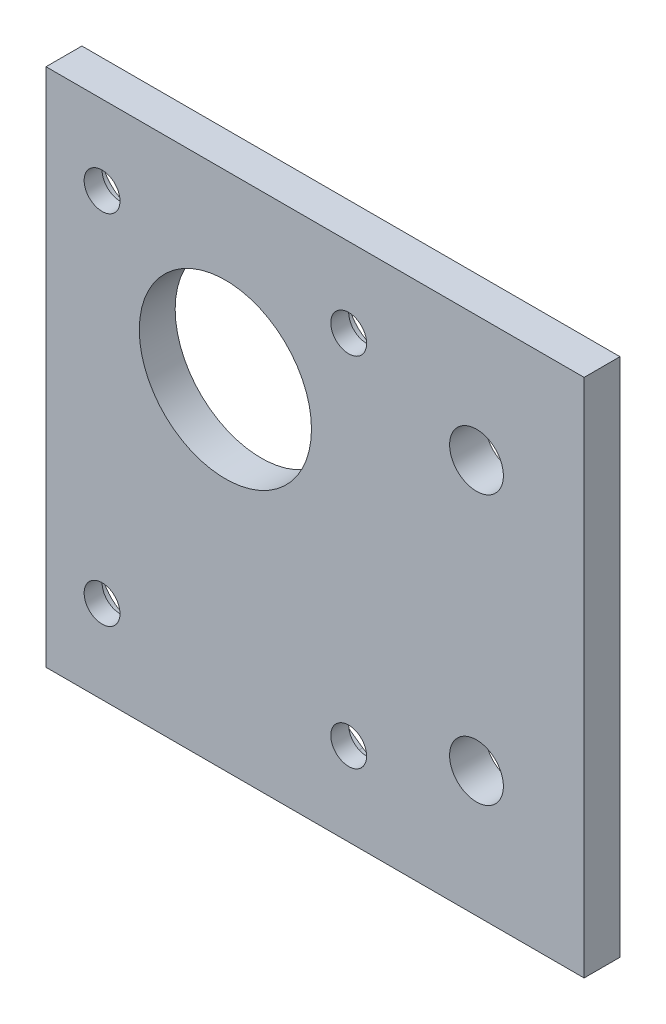
from build123d import *

# Parameters (mm, degrees)
SKETCH1_W           = 60
SKETCH1_H           = 58
SKETCH1_R           = 4.2
SKETCH1_R_2         = 9.6
BOSS_EXTRUDE1_DEPTH = 2
SKETCH4_W           = 60
SKETCH4_H           = 58
SKETCH4_R           = 2
SKETCH4_R_2         = 9.6
BOSS_EXTRUDE3_DEPTH = 2
SKETCH5_R           = 3
CUT_EXTRUDE1_DEPTH  = 4


with BuildPart() as part:
    # Sketch1 → Boss-Extrude1 (new body)
    with BuildSketch(Plane.XY):
        with Locations((10, 0)):
            Rectangle(SKETCH1_W, SKETCH1_H)
        with Locations((13.75, 20.15)):
            Circle(SKETCH1_R, mode=Mode.SUBTRACT)
        with Locations((-13.75, -19.7)):
            Circle(SKETCH1_R, mode=Mode.SUBTRACT)
        with Locations((-5.725, -6.1)):
            Circle(SKETCH1_R, mode=Mode.SUBTRACT)
        with Locations((5.725, -6.1)):
            Circle(SKETCH1_R, mode=Mode.SUBTRACT)
        with BuildLine():
            ThreePointArc((16.186, -16.278610808), (17.171389192, -22.136), (11.314, -23.121389192))
            Line((11.314, -23.121389192), (7.240917629, -20.221389192))
            ThreePointArc((7.240917629, -20.221389192), (6.255528438, -14.364), (12.112917629, -13.378610808))
            Line((12.112917629, -13.378610808), (16.186, -16.278610808))
        make_face(mode=Mode.SUBTRACT)
        with Locations((0, 8.8)):
            Circle(SKETCH1_R_2, mode=Mode.SUBTRACT)
        with Locations((-13.75, 20.15)):
            Circle(SKETCH1_R, mode=Mode.SUBTRACT)
    extrude(amount=BOSS_EXTRUDE1_DEPTH)

    # Sketch4 → Boss-Extrude3 (add)
    with BuildSketch(Plane.XY.offset(2)):
        with Locations((10, 0)):
            Rectangle(SKETCH4_W, SKETCH4_H)
        with Locations((-13.75, -19.7)):
            Circle(SKETCH4_R, mode=Mode.SUBTRACT)
        with Locations((-13.75, 20.15)):
            Circle(SKETCH4_R, mode=Mode.SUBTRACT)
        with Locations((13.75, 20.15)):
            Circle(SKETCH4_R, mode=Mode.SUBTRACT)
        with Locations((13.75, -19.7)):
            Circle(SKETCH4_R, mode=Mode.SUBTRACT)
        with Locations((0, 8.8)):
            Circle(SKETCH4_R_2, mode=Mode.SUBTRACT)
    extrude(amount=BOSS_EXTRUDE3_DEPTH)

    # Sketch5 → Cut-Extrude1 (cut)
    with BuildSketch(Plane.XY.offset(4)):
        with Locations((28, 15)):
            Circle(SKETCH5_R)
        with Locations((28, -15)):
            Circle(SKETCH5_R)
    extrude(amount=-CUT_EXTRUDE1_DEPTH, mode=Mode.SUBTRACT)


solid = part.part
